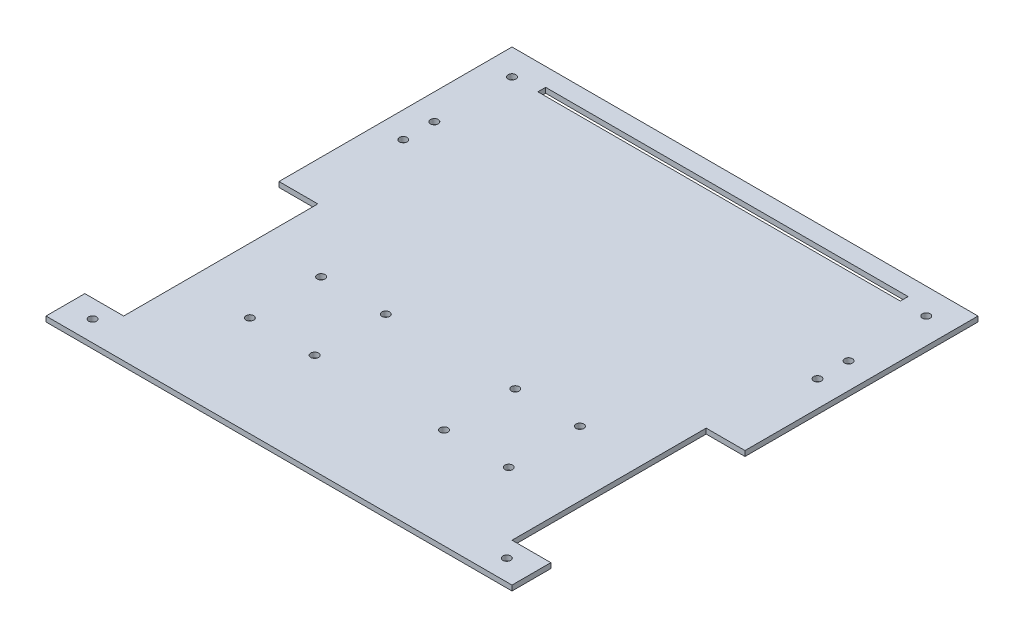
from build123d import *

# Parameters (mm, degrees)
SKETCH1_W           = 180
SKETCH1_H           = 180
BOSS_EXTRUDE1_DEPTH = 2
SKETCH2_R           = 1.5
SKETCH2_W           = 15
SKETCH2_H           = 75
SKETCH2_W_2         = 140
SKETCH2_H_2         = 3
CUT_EXTRUDE1_DEPTH  = 2
SKETCH3_R           = 1.5
CUT_EXTRUDE2_DEPTH  = 3


with BuildPart() as part:
    # Sketch1 → Boss-Extrude1 (new body)
    with BuildSketch(Plane(origin=(0, 0, 0), x_dir=(1, 0, 0), z_dir=(0, 1, 0))):
        Rectangle(SKETCH1_W, SKETCH1_H)
    extrude(amount=BOSS_EXTRUDE1_DEPTH)

    # Sketch2 → Cut-Extrude1 (cut)
    with BuildSketch(Plane(origin=(0, 2, 0), x_dir=(1, 0, 0), z_dir=(0, 1, 0))):
        with Locations(Location((-80, 38, 0), (0, 0, 270))):
            Circle(SKETCH2_R)
        with Locations(Location((-80, -82, 0), (0, 0, 270))):
            Circle(SKETCH2_R)
        with Locations(Location((80, -82, 0), (0, 0, 90))):
            Circle(SKETCH2_R)
        with Locations(Location((80, 38, 0), (0, 0, 90))):
            Circle(SKETCH2_R)
        with Locations(Location((-80, 80, 0), (0, 0, 270))):
            Circle(SKETCH2_R)
        with Locations(Location((-80, 50, 0), (0, 0, 270))):
            Circle(SKETCH2_R)
        with Locations(Location((80, 50, 0), (0, 0, 90))):
            Circle(SKETCH2_R)
        with Locations(Location((80, 80, 0), (0, 0, 90))):
            Circle(SKETCH2_R)
        with Locations((-82.5, -37.5)):
            Rectangle(SKETCH2_W, SKETCH2_H)
        with Locations((82.5, -37.5)):
            Rectangle(SKETCH2_W, SKETCH2_H)
        with Locations((0, 81.5)):
            Rectangle(SKETCH2_W_2, SKETCH2_H_2)
    extrude(amount=-CUT_EXTRUDE1_DEPTH, mode=Mode.SUBTRACT)

    # Sketch3 → Cut-Extrude2 (cut)
    with BuildSketch(Plane(origin=(0, 2, 0), x_dir=(1, 0, 0), z_dir=(0, 1, 0))):
        with Locations(Location((-50, -23.75, 0), (0, 0, 270))):
            Circle(SKETCH3_R)
        with Locations(Location((-50, -51.25, 0), (0, 0, 270))):
            Circle(SKETCH3_R)
        with Locations(Location((-25, -23.75, 0), (0, 0, 270))):
            Circle(SKETCH3_R)
        with Locations(Location((-25, -51.25, 0), (0, 0, 270))):
            Circle(SKETCH3_R)
        with Locations(Location((25, -23.75, 0), (0, 0, 270))):
            Circle(SKETCH3_R)
        with Locations(Location((50, -23.75, 0), (0, 0, 270))):
            Circle(SKETCH3_R)
        with Locations(Location((25, -51.25, 0), (0, 0, 270))):
            Circle(SKETCH3_R)
        with Locations(Location((50, -51.25, 0), (0, 0, 270))):
            Circle(SKETCH3_R)
    extrude(amount=-CUT_EXTRUDE2_DEPTH, mode=Mode.SUBTRACT)


solid = part.part
